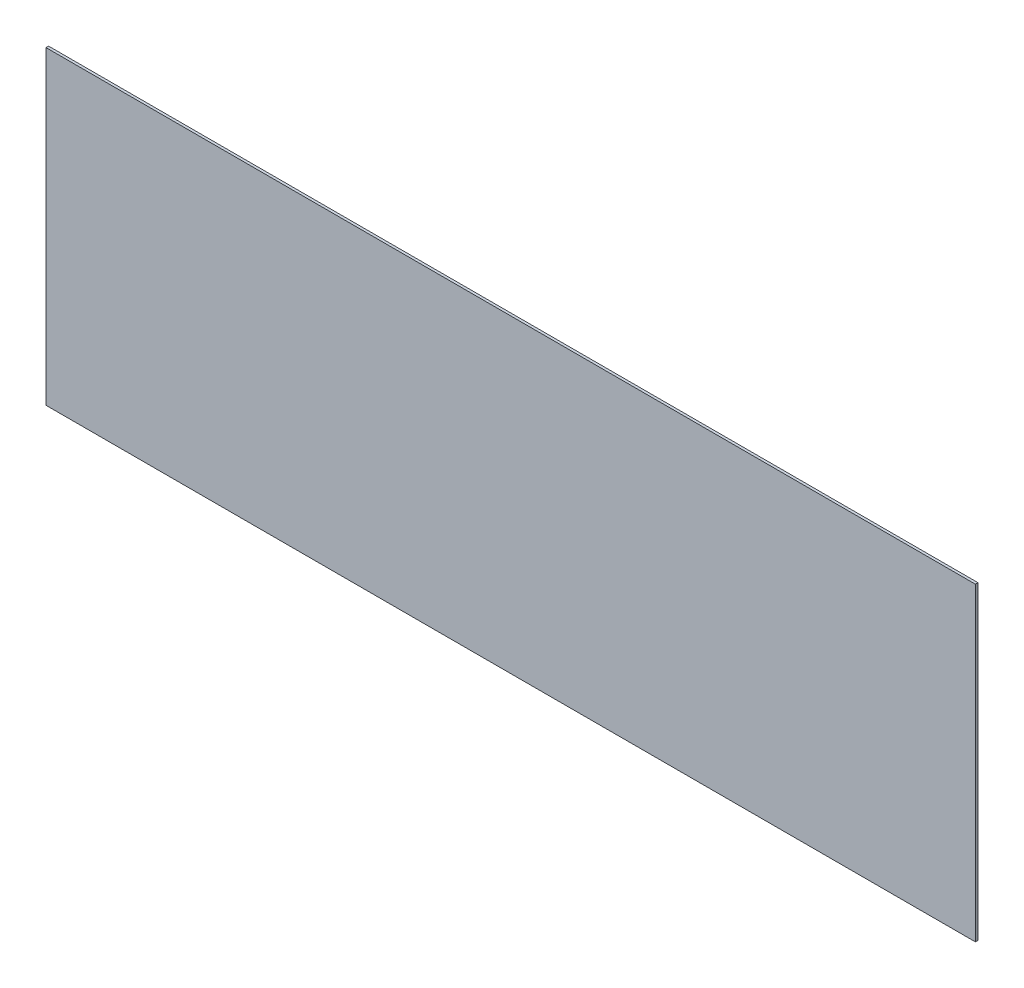
from build123d import *

# Parameters (mm, degrees)
SKETCH1_W           = 1800
SKETCH1_H           = 600
BOSS_EXTRUDE1_DEPTH = 5


with BuildPart() as part:
    # Sketch1 → Boss-Extrude1 (new body)
    with BuildSketch(Plane.XY):
        Rectangle(SKETCH1_W, SKETCH1_H)
    extrude(amount=BOSS_EXTRUDE1_DEPTH)


solid = part.part
